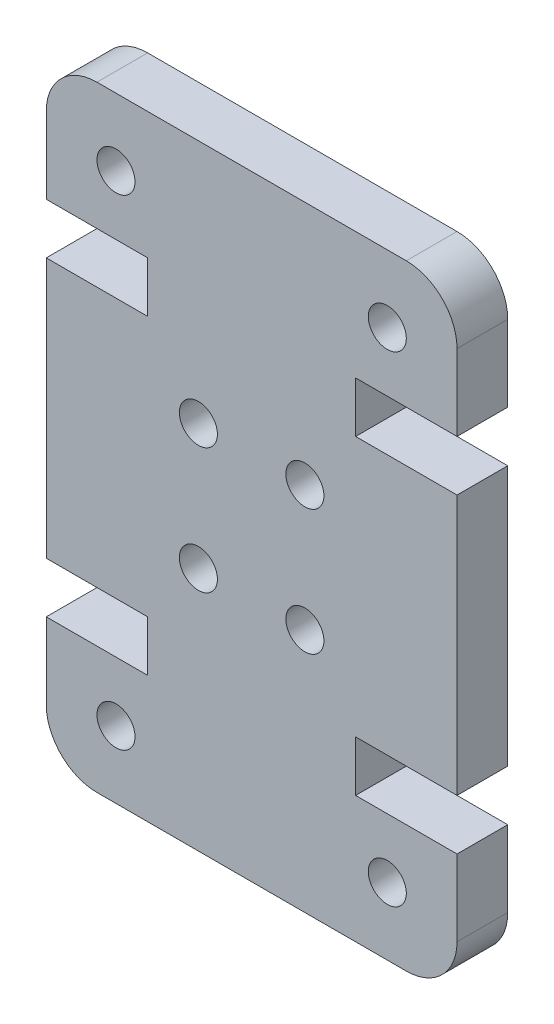
from build123d import *

# Parameters (mm, degrees)
SKETCH1_R           = 0.75
BOSS_EXTRUDE1_DEPTH = 2


with BuildPart() as part:
    # Sketch1 → Boss-Extrude1 (new body)
    with BuildSketch(Plane.XY):
        with BuildLine():
            Line((16.2, 17.26), (16.2, 7))
            Line((16.2, 7), (12.2, 7))
            Line((12.2, 7), (12.2, 5))
            Line((12.2, 5), (16.2, 5))
            Line((16.2, 5), (16.2, 2))
            ThreePointArc((16.2, 2), (15.614213562, 0.585786438), (14.2, 0))
            Line((14.2, 0), (2, 0))
            ThreePointArc((2, 0), (0.585786438, 0.585786438), (0, 2))
            Line((0, 2), (0, 5))
            Line((0, 5), (4, 5))
            Line((4, 5), (4, 7))
            Line((4, 7), (0, 7))
            Line((0, 7), (0, 17.26))
            Line((0, 17.26), (4, 17.26))
            Line((4, 17.26), (4, 19.26))
            Line((4, 19.26), (0, 19.26))
            Line((0, 19.26), (0, 22.26))
            ThreePointArc((0, 22.26), (0.585786438, 23.674213562), (2, 24.26))
            Line((2, 24.26), (14.2, 24.26))
            ThreePointArc((14.2, 24.26), (15.614213562, 23.674213562), (16.2, 22.26))
            Line((16.2, 22.26), (16.2, 19.26))
            Line((16.2, 19.26), (12.2, 19.26))
            Line((12.2, 19.26), (12.2, 17.26))
            Line((12.2, 17.26), (16.2, 17.26))
        make_face()
        with Locations(Location((13.45, 2.653551169, 0), (0, 0, 180))):
            Circle(SKETCH1_R, mode=Mode.SUBTRACT)
        with Locations(Location((10.2, 9.653551169, 0), (0, 0, 180))):
            Circle(SKETCH1_R, mode=Mode.SUBTRACT)
        with Locations(Location((2.75, 21.606448831, 0), (0, 0, 180))):
            Circle(SKETCH1_R, mode=Mode.SUBTRACT)
        with Locations(Location((6, 14.606448831, 0), (0, 0, 180))):
            Circle(SKETCH1_R, mode=Mode.SUBTRACT)
        with Locations((10.2, 14.606448831)):
            Circle(SKETCH1_R, mode=Mode.SUBTRACT)
        with Locations((13.45, 21.606448831)):
            Circle(SKETCH1_R, mode=Mode.SUBTRACT)
        with Locations((6, 9.653551169)):
            Circle(SKETCH1_R, mode=Mode.SUBTRACT)
        with Locations((2.75, 2.653551169)):
            Circle(SKETCH1_R, mode=Mode.SUBTRACT)
    extrude(amount=BOSS_EXTRUDE1_DEPTH)


solid = part.part
